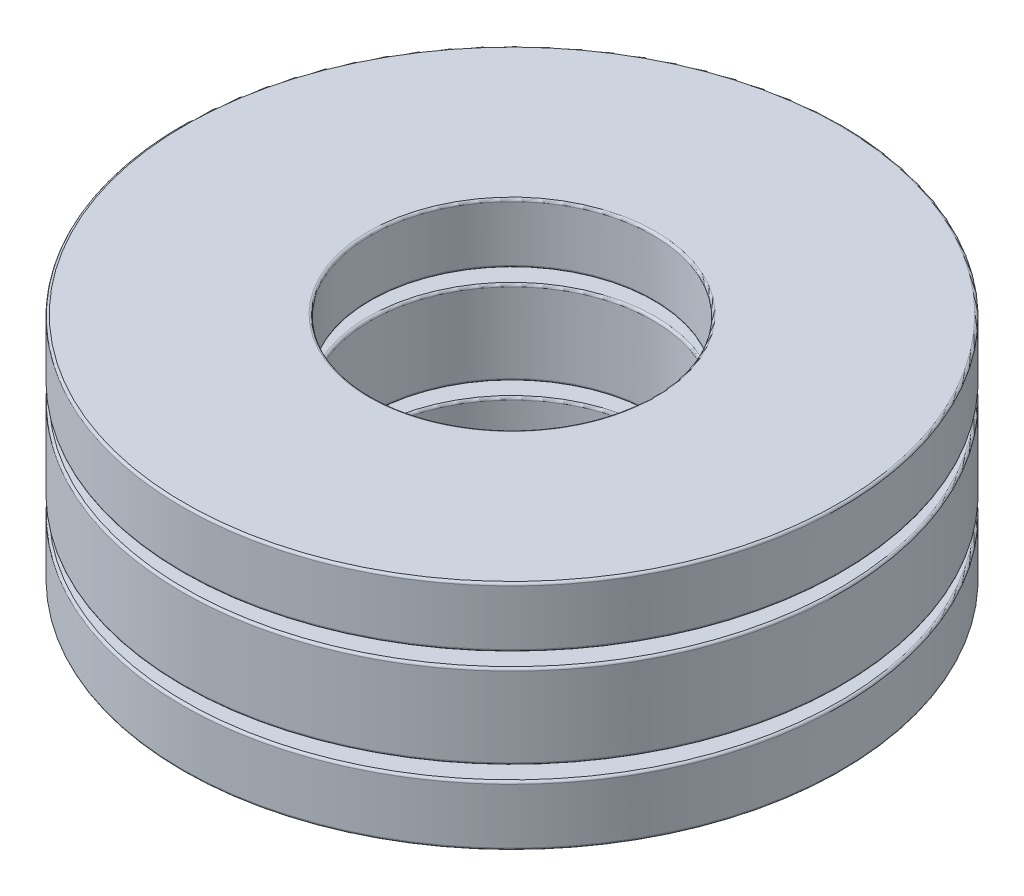
from build123d import *

# Parameters (mm, degrees)
SKETCH3_W         = 4
SKETCH3_H         = 1.785
CIRPATTERN1_COUNT = 8
CIRPATTERN1_ANGLE = 315
CIRPATTERN2_COUNT = 8
SKETCH6_W         = 4
SKETCH6_H         = 1.27
FILLET1_R         = 0.0492
FILLET2_R         = 0.0492
FILLET3_R         = 0.0492


with BuildPart() as part:
    # Sketch3 → Revolve1 (revolve)
    with BuildSketch(Plane.XY, mode=Mode.PRIVATE) as revolve1_sk:
        with Locations((5, 0)):
            Rectangle(SKETCH3_W, SKETCH3_H)
    revolve(revolve1_sk.sketch.rotate(Axis((0, 2.46, 0), (0, -1, 0)), 90), axis=Axis((0, 2.46, 0), (0, -1, 0)))

    # Sketch4 → Cut-Revolve1 (revolve, cut)
    with BuildSketch(Plane.XY):
        with BuildLine():
            Line((5.15, 1.19), (5.15, -1.19))
            ThreePointArc((5.15, -1.19), (3.96, 0), (5.15, 1.19))
        make_face()
    cut_revolve1 = revolve(axis=Axis((5.15, 1.19, 0), (0, -1, 0)), mode=Mode.SUBTRACT)

    # CirPattern2: Cut-Revolve1 ×8 about axis
    cirpattern2_axis = Axis((0, 0, 0), (0, 1, 0))
    for i in range(1, CIRPATTERN2_COUNT):
        add(cut_revolve1.rotate(cirpattern2_axis, i * 360 / CIRPATTERN2_COUNT), mode=Mode.SUBTRACT)

    # Fillet2
    fillet2_edges = [part.edges().sort_by_distance(p)[0] for p in [
        (5.937111015, 0.8925, 0),
        (5.937111015, -0.8925, 0),
        (4.198171459, 0.8925, 4.198171459),
        (4.198171459, -0.8925, 4.198171459),
        (0, 0.8925, 5.937111015),
        (0, -0.8925, 5.937111015),
        (-4.198171459, 0.8925, 4.198171459),
        (-4.198171459, -0.8925, 4.198171459),
        (-5.937111015, 0.8925, 0),
        (-5.937111015, -0.8925, 0),
        (-4.198171459, 0.8925, -4.198171459),
        (-4.198171459, -0.8925, -4.198171459),
        (0, 0.8925, -5.937111015),
        (0, -0.8925, -5.937111015),
        (4.198171459, 0.8925, -4.198171459),
        (4.198171459, -0.8925, -4.198171459),
        (0, 0.8925, -7),
        (0, 0.8925, -3),
        (0, -0.8925, -3),
        (0, -0.8925, -7),
    ]]
    fillet(fillet2_edges, radius=FILLET2_R)


with BuildPart() as body_2:
    # Sketch5 → Revolve2 (revolve)
    with BuildSketch(Plane.XY):
        with BuildLine():
            Line((5.15, 1.19), (5.15, -1.19))
            ThreePointArc((5.15, -1.19), (3.96, 0), (5.15, 1.19))
        make_face()
    revolve(axis=Axis((5.15, 1.19, 0), (0, -1, 0)))


with BuildPart() as cirpattern1_1:
    # CirPattern1: pattern copy
    add(body_2.part.rotate(Axis((0, 2.46, 0), (0, -1, 0)), 1 * CIRPATTERN1_ANGLE / (CIRPATTERN1_COUNT - 1)))


with BuildPart() as cirpattern1_2:
    # CirPattern1: pattern copy
    add(body_2.part.rotate(Axis((0, 2.46, 0), (0, -1, 0)), 2 * CIRPATTERN1_ANGLE / (CIRPATTERN1_COUNT - 1)))


with BuildPart() as cirpattern1_3:
    # CirPattern1: pattern copy
    add(body_2.part.rotate(Axis((0, 2.46, 0), (0, -1, 0)), 3 * CIRPATTERN1_ANGLE / (CIRPATTERN1_COUNT - 1)))


with BuildPart() as cirpattern1_4:
    # CirPattern1: pattern copy
    add(body_2.part.rotate(Axis((0, 2.46, 0), (0, -1, 0)), 4 * CIRPATTERN1_ANGLE / (CIRPATTERN1_COUNT - 1)))


with BuildPart() as cirpattern1_5:
    # CirPattern1: pattern copy
    add(body_2.part.rotate(Axis((0, 2.46, 0), (0, -1, 0)), 5 * CIRPATTERN1_ANGLE / (CIRPATTERN1_COUNT - 1)))


with BuildPart() as cirpattern1_6:
    # CirPattern1: pattern copy
    add(body_2.part.rotate(Axis((0, 2.46, 0), (0, -1, 0)), 6 * CIRPATTERN1_ANGLE / (CIRPATTERN1_COUNT - 1)))


with BuildPart() as cirpattern1_7:
    # CirPattern1: pattern copy
    add(body_2.part.rotate(Axis((0, 2.46, 0), (0, -1, 0)), 7 * CIRPATTERN1_ANGLE / (CIRPATTERN1_COUNT - 1)))


with BuildPart() as body_10:
    # Sketch6 → Revolve3 (revolve)
    with BuildSketch(Plane.XY, mode=Mode.PRIVATE) as revolve3_sk:
        with Locations((5, 1.825)):
            Rectangle(SKETCH6_W, SKETCH6_H)
        with Locations((5, -1.825)):
            Rectangle(SKETCH6_W, SKETCH6_H)
    revolve(revolve3_sk.sketch.rotate(Axis((0, 2.46, 0), (0, -1, 0)), 90), axis=Axis((0, 2.46, 0), (0, -1, 0)))

    # Fillet1
    fillet1_edges = [body_10.edges().sort_by_distance(p)[0] for p in [
        (0, 2.46, -7),
        (0, 2.46, -3),
        (0, 1.19, -3),
        (0, 1.19, -7),
    ]]
    fillet(fillet1_edges, radius=FILLET1_R)

    # Fillet3
    fillet3_edges = [body_10.edges().sort_by_distance(p)[0] for p in [
        (0, -1.19, -7),
        (0, -1.19, -3),
        (0, -2.46, -3),
        (0, -2.46, -7),
    ]]
    fillet(fillet3_edges, radius=FILLET3_R)


solid = Compound([part.part, body_2.part, cirpattern1_1.part, cirpattern1_2.part, cirpattern1_3.part, cirpattern1_4.part, cirpattern1_5.part, cirpattern1_6.part, cirpattern1_7.part, body_10.part])
